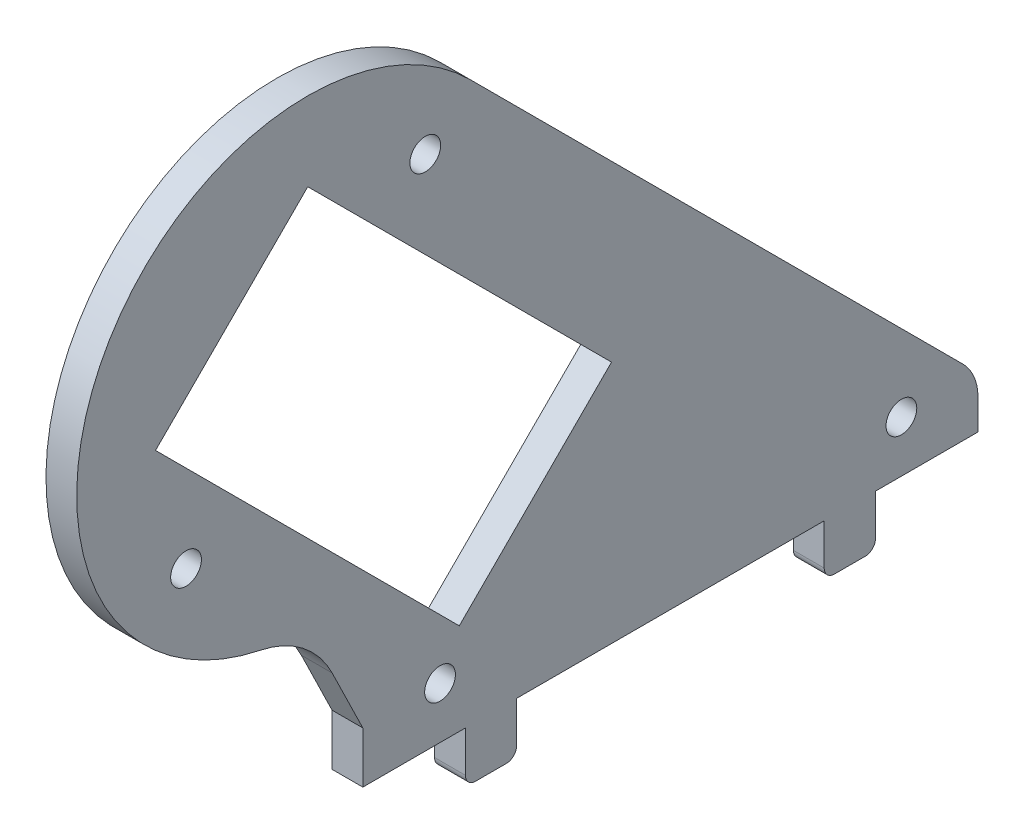
from build123d import *

# Parameters (mm, degrees)
BOSS_EXTRUDE1_DEPTH = 3
CUT_EXTRUDE2_DEPTH  = 10
SKETCH5_R           = 1.5
CUT_EXTRUDE3_DEPTH  = 10
FILLET1_R           = 10
FILLET2_R           = 1
FILLET3_R           = 5


with BuildPart() as part:
    # Sketch3 → Boss-Extrude1 (new body)
    with BuildSketch(Plane(origin=(0, 0, 0), x_dir=(0, 0, -1), z_dir=(1, 0, 0))):
        with BuildLine():
            Line((15, -2.5), (20, -2.5))
            Line((20, -2.5), (20, 2.5))
            Line((20, 2.5), (30, 2.5))
            Line((30, 2.5), (30, 7.5))
            Line((30, 7.5), (-19.497474683, 56.997474683))
            ThreePointArc((-19.497474683, 56.997474683), (-56.194666741, 49.697949335), (-35.40737726, 18.587572106))
            Line((-35.40737726, 18.587572106), (-30, 7.5))
            Line((-30, 7.5), (-30, 2.5))
            Line((-30, 2.5), (-20, 2.5))
            Line((-20, 2.5), (-20, -2.5))
            Line((-20, -2.5), (-15, -2.5))
            Line((-15, -2.5), (-15, 2.5))
            Line((-15, 2.5), (15, 2.5))
            Line((15, 2.5), (15, -2.5))
        make_face()
    extrude(amount=BOSS_EXTRUDE1_DEPTH)

    # Sketch4 → Cut-Extrude2 (cut)
    with BuildSketch(Plane.ZY):
        Polygon((35.372021921, 55.901459172), (5.744247789, 26.273685041), (20.593490194, 11.424442636), (50.221264326, 41.052216767), align=None)
    extrude(amount=-CUT_EXTRUDE2_DEPTH, mode=Mode.SUBTRACT)

    # Sketch5 → Cut-Extrude3 (cut)
    with BuildSketch(Plane.ZY):
        with Locations((22.471283385, 7.5)):
            Circle(SKETCH5_R)
        with Locations((-22.528716615, 7.5)):
            Circle(SKETCH5_R)
        with Locations((23.910377597, 52.925096223)):
            Circle(SKETCH5_R)
        with Locations((47.244901376, 29.590572444)):
            Circle(SKETCH5_R)
    extrude(amount=-CUT_EXTRUDE3_DEPTH, mode=Mode.SUBTRACT)

    # Fillet1
    fillet1_edges = [part.edges().sort_by_distance(p)[0] for p in [
        (1.5, 18.587572106, 35.40737726),
    ]]
    fillet(fillet1_edges, radius=FILLET1_R)

    # Fillet2
    fillet2_edges = [part.edges().sort_by_distance(p)[0] for p in [
        (1.5, -2.5, -20),
        (1.5, -2.5, -15),
        (1.5, -2.5, 15),
        (1.5, -2.5, 20),
    ]]
    fillet(fillet2_edges, radius=FILLET2_R)

    # Fillet3
    fillet3_edges = [part.edges().sort_by_distance(p)[0] for p in [
        (1.5, 7.5, -30),
    ]]
    fillet(fillet3_edges, radius=FILLET3_R)


solid = part.part
